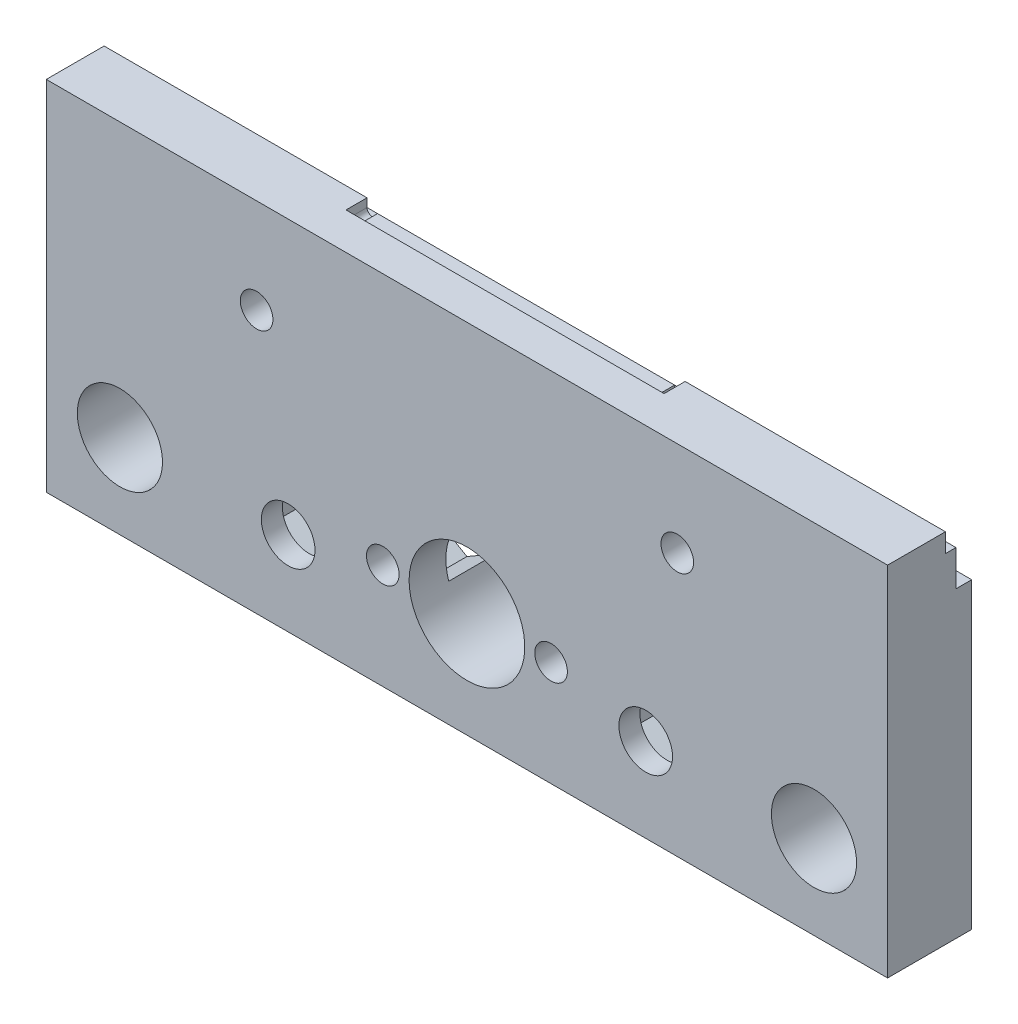
from build123d import *

# Parameters (mm, degrees)
SKETCH_2_W           = 80
SKETCH_2_H           = 34
SKETCH_2_R           = 4.05
EXTRUDE_1_DEPTH      = 8
SKETCH_3_R           = 2.55
CUT_EXTRUDE_1_DEPTH  = 88.292611371
CUT_EXTRUDE_2_DEPTH  = 88.292611371
SKETCH_5_R           = 1.55
CUT_EXTRUDE_3_DEPTH  = 88.292611371
CUT_EXTRUDE_5_DEPTH  = 4.5
SKETCH_11_R          = 1.55
CUT_EXTRUDE_7_DEPTH  = 88.292611371
CUT_EXTRUDE_11_DEPTH = 2
CUT_EXTRUDE_13_DEPTH = 6
SKETCH_20_R          = 5.5
CUT_EXTRUDE_14_DEPTH = 88.292611371


with BuildPart() as part:
    # 草图2 → 凸台-拉伸1 (new body)
    with BuildSketch(Plane.XY):
        with Locations((40, 17)):
            Rectangle(SKETCH_2_W, SKETCH_2_H)
        with Locations((7, 8)):
            Circle(SKETCH_2_R, mode=Mode.SUBTRACT)
        with Locations((40, 10)):
            Circle(SKETCH_2_R, mode=Mode.SUBTRACT)
        with Locations((73, 8)):
            Circle(SKETCH_2_R, mode=Mode.SUBTRACT)
    extrude(amount=EXTRUDE_1_DEPTH)

    # 草图3 → 切除-拉伸1 (cut, through all)
    with BuildSketch(Plane.XY.offset(8)):
        with Locations((23, 8)):
            Circle(SKETCH_3_R)
        with Locations((57, 8)):
            Circle(SKETCH_3_R)
    extrude(amount=-CUT_EXTRUDE_1_DEPTH, mode=Mode.SUBTRACT)

    # 草图4 → 切除-拉伸2 (cut, through all)
    with BuildSketch(Plane(origin=(80, 0, 0), x_dir=(0, 0, -1), z_dir=(1, 0, 0))):
        Polygon((-1.5, 32.2), (-2.5, 32.2), (-2.5, 34), (0, 34), (0, 28.8), (-1.5, 28.8), align=None)
    extrude(amount=-CUT_EXTRUDE_2_DEPTH, mode=Mode.SUBTRACT)

    # 草图5 → 切除-拉伸3 (cut, through all)
    with BuildSketch(Plane.XY.offset(8)):
        with Locations((48, 10)):
            Circle(SKETCH_5_R)
        with Locations((32, 10)):
            Circle(SKETCH_5_R)
    extrude(amount=-CUT_EXTRUDE_3_DEPTH, mode=Mode.SUBTRACT)

    # 草图8 → 切除-拉伸5 (cut)
    with BuildSketch(Plane(origin=(0, 0, 0), x_dir=(-1, 0, 0), z_dir=(0, 0, -1))):
        Polygon((-45.15, 8.354551733), (-45.15, 11.645448267), (-48, 13.290896534), (-50.85, 11.645448267), (-50.85, 8.354551733), (-48, 6.709103466), align=None)
        Polygon((-29.15, 8.354551733), (-29.15, 11.645448267), (-32, 13.290896534), (-34.85, 11.645448267), (-34.85, 8.354551733), (-32, 6.709103466), align=None)
    extrude(amount=-CUT_EXTRUDE_5_DEPTH, mode=Mode.SUBTRACT)

    # 草图11 → 切除-拉伸7 (cut, through all)
    with BuildSketch(Plane(origin=(0, 0, 0), x_dir=(-1, 0, 0), z_dir=(0, 0, -1))):
        with Locations((-60, 25)):
            Circle(SKETCH_11_R)
        with Locations((-20, 25)):
            Circle(SKETCH_11_R)
    extrude(amount=-CUT_EXTRUDE_7_DEPTH, mode=Mode.SUBTRACT)

    # 草图19 → 切除-拉伸11 (cut)
    with BuildSketch(Plane(origin=(0, 0, 2.5), x_dir=(-1, 0, 0), z_dir=(0, 0, -1))):
        with BuildLine():
            Line((-25, 34), (-55.247938178, 34))
            Line((-55.247938178, 34), (-55.247938178, 33.2))
            ThreePointArc((-55.247938178, 33.2), (-54.747938178, 32.7), (-54.247938178, 33.2))
            Line((-54.247938178, 33.2), (-26, 33.2))
            ThreePointArc((-26, 33.2), (-25.5, 32.7), (-25, 33.2))
            Line((-25, 33.2), (-25, 34))
        make_face()
    extrude(amount=-CUT_EXTRUDE_11_DEPTH, mode=Mode.SUBTRACT)

    # 草图7 → 切除-拉伸13 (cut)
    with BuildSketch(Plane(origin=(0, 0, 0), x_dir=(-1, 0, 0), z_dir=(0, 0, -1))):
        Polygon((-52.9, 5.632863896), (-52.9, 10.367136104), (-57, 12.734272207), (-61.1, 10.367136104), (-61.1, 5.632863896), (-57, 3.265727793), align=None)
        Polygon((-18.9, 5.632863896), (-18.9, 10.367136104), (-23, 12.734272207), (-27.1, 10.367136104), (-27.1, 5.632863896), (-23, 3.265727793), align=None)
    extrude(amount=-CUT_EXTRUDE_13_DEPTH, mode=Mode.SUBTRACT)

    # 草图20 → 切除-拉伸14 (cut, through all)
    with BuildSketch(Plane(origin=(0, 0, 0), x_dir=(-1, 0, 0), z_dir=(0, 0, -1))):
        with Locations((-40, 10)):
            Circle(SKETCH_20_R)
    extrude(amount=-CUT_EXTRUDE_14_DEPTH, mode=Mode.SUBTRACT)


solid = part.part
